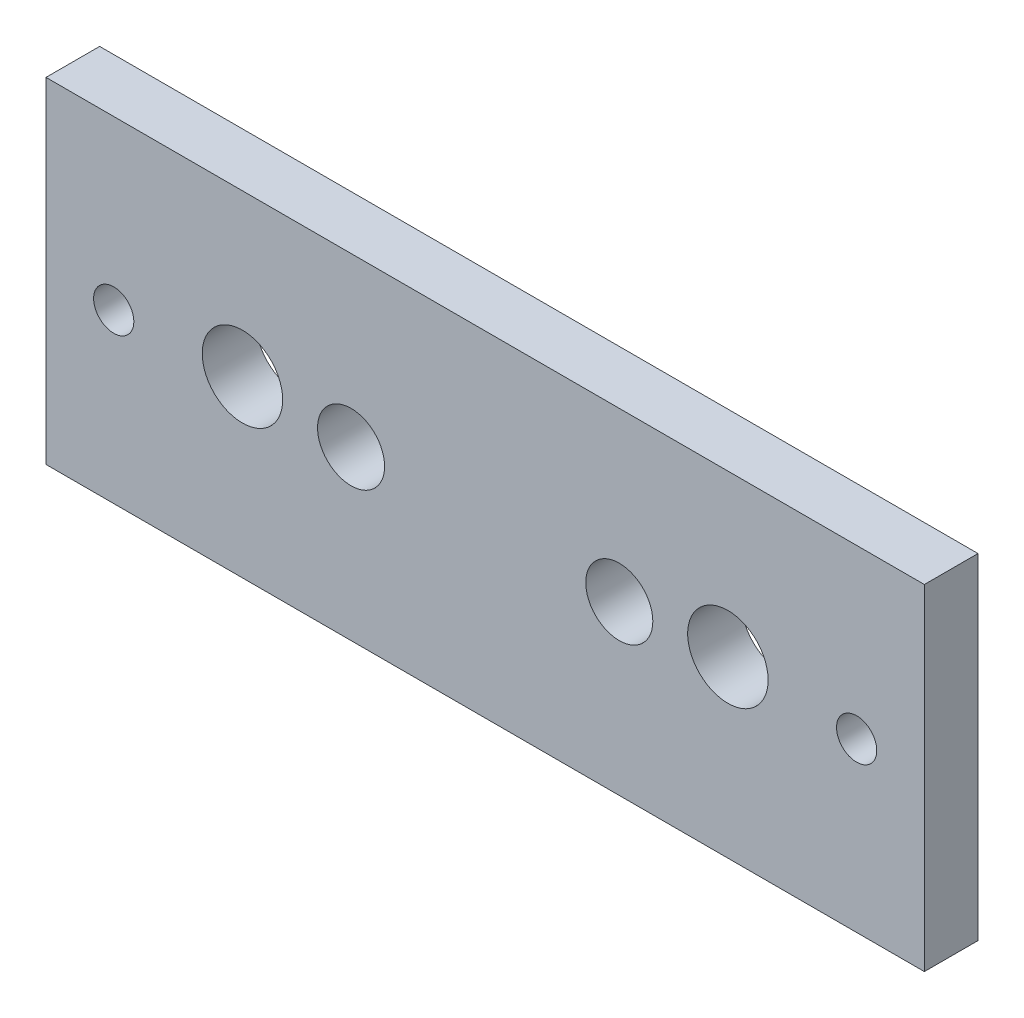
from build123d import *

# Parameters (mm, degrees)
SKETCH1_W             = 65.5
SKETCH1_H             = 25
BOSS_EXTRUDE1_DEPTH   = 4
F_5_0MM_DOWEL_HOLE1_D = 5
SKETCH4_R             = 3
CUT_EXTRUDE1_DEPTH    = 71.222859526
F_3_0MM_DOWEL_HOLE1_D = 3


with BuildPart() as part:
    # Sketch1 → Boss-Extrude1 (new body)
    with BuildSketch(Plane.XY):
        with Locations((32.75, 12.5)):
            Rectangle(SKETCH1_W, SKETCH1_H)
    extrude(amount=BOSS_EXTRUDE1_DEPTH)

    # Ø5.0mm Dowel Hole1 (through all)
    with Locations(Plane.XY.offset(4)):
        with Locations((22.75, 12.5), (42.75, 12.5)):
            Hole(F_5_0MM_DOWEL_HOLE1_D / 2)

    # Sketch4 → Cut-Extrude1 (cut, through all)
    with BuildSketch(Plane.XY.offset(4)):
        with Locations((14.65, 13)):
            Circle(SKETCH4_R)
        with Locations((50.85, 13)):
            Circle(SKETCH4_R)
    extrude(amount=-CUT_EXTRUDE1_DEPTH, mode=Mode.SUBTRACT)

    # Ø3.0mm Dowel Hole1 (through all)
    with Locations(Plane.XY.offset(4)):
        with Locations((5.05, 12.5), (60.45, 12.5)):
            Hole(F_3_0MM_DOWEL_HOLE1_D / 2)


solid = part.part
